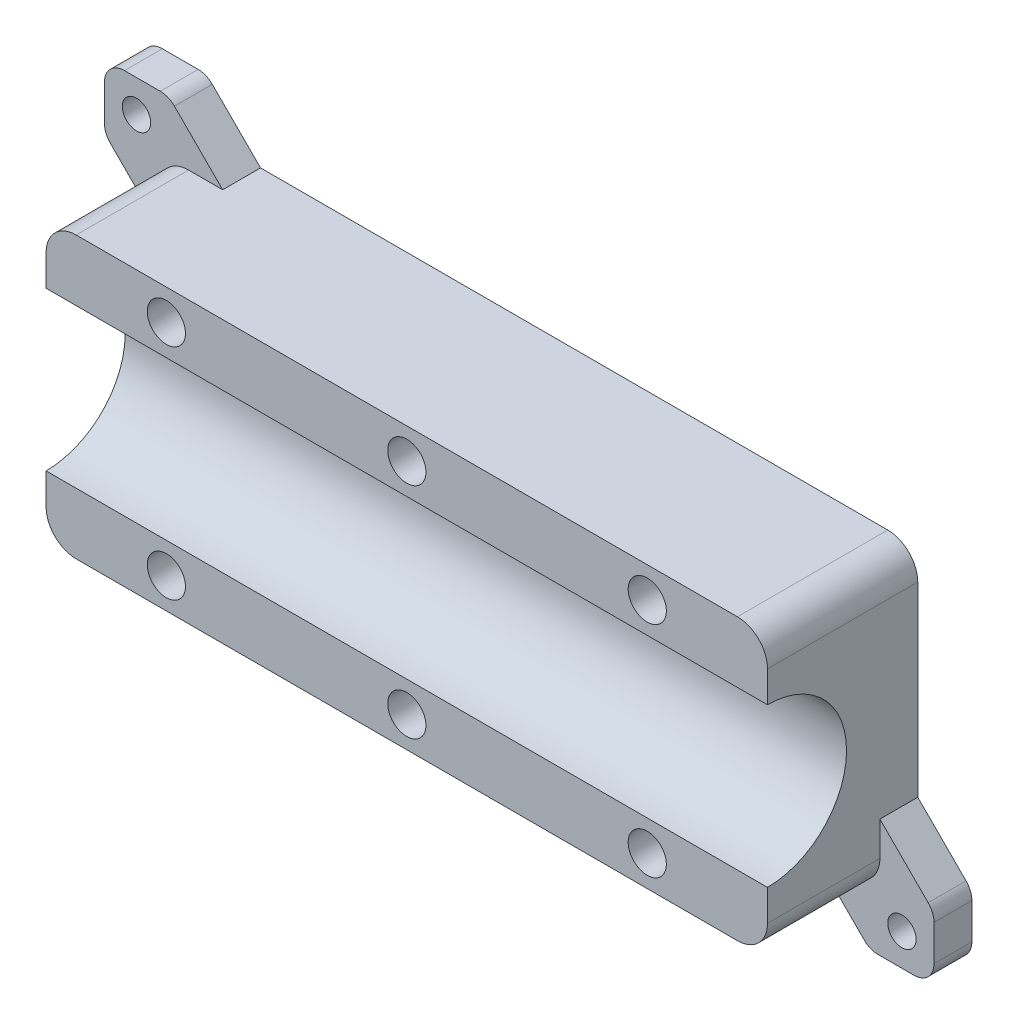
from build123d import *

# Parameters (mm, degrees)
SKETCH1_W               = 114.3
SKETCH1_H               = 44.45
BOSS_EXTRUDE1_DEPTH     = 5
BOSS_EXTRUDE2_DEPTH     = 114.3
SKETCH3_R               = 3.025
CUT_EXTRUDE1_DEPTH      = 5.5
LPATTERN1_COUNT         = 2
LPATTERN1_PITCH         = 38.1
LPATTERN1_COL_COUNT     = 2
LPATTERN1_COL_PITCH     = 38.1
MIRROR1_COPY_1_SKETCH_R = 3.025
MIRROR1_COPY_1_DEPTH    = 5.5
MIRROR1_COPY_2_SKETCH_R = 3.025
MIRROR1_COPY_2_DEPTH    = 5.5
SKETCH4_W               = 10.16
SKETCH4_H               = 10.16
BOSS_EXTRUDE3_DEPTH     = 6
M4_CLEARANCE_HOLE1_D    = 4.5
FILLET3_R               = 3.175
FILLET4_R               = 4.7625


with BuildPart() as part:
    # Sketch1 → Boss-Extrude1 (new body)
    with BuildSketch(Plane.XY):
        Rectangle(SKETCH1_W, SKETCH1_H)
    extrude(amount=BOSS_EXTRUDE1_DEPTH)

    # Sketch2 → Boss-Extrude2 (add)
    with BuildSketch(Plane.ZY.offset(57.15)):
        with BuildLine():
            Line((23.8125, 22.225), (5, 22.225))
            Line((5, 22.225), (5, -22.225))
            Line((5, -22.225), (23.8125, -22.225))
            Line((23.8125, -22.225), (23.8125, -12.5269))
            ThreePointArc((23.8125, -12.5269), (11.2856, 0), (23.8125, 12.5269))
            Line((23.8125, 12.5269), (23.8125, 22.225))
        make_face()
    extrude(amount=-BOSS_EXTRUDE2_DEPTH)

    # Sketch3 → Cut-Extrude1 (cut)
    with BuildSketch(Plane.XY.offset(23.8125)):
        with Locations((0, 17.37595)):
            Circle(SKETCH3_R)
    cut_extrude1 = extrude(amount=-CUT_EXTRUDE1_DEPTH, mode=Mode.SUBTRACT)

    # LPattern1: Cut-Extrude1 ×2
    with Locations(*[(i * LPATTERN1_PITCH, 0, 0) for i in range(1, LPATTERN1_COUNT)]):
        add(cut_extrude1, mode=Mode.SUBTRACT)

    # LPattern1 col: Cut-Extrude1 ×2
    with Locations(*[(-i * LPATTERN1_COL_PITCH, 0, 0) for i in range(1, LPATTERN1_COL_COUNT)]):
        add(cut_extrude1, mode=Mode.SUBTRACT)

    # Mirror1: Cut-Extrude1 across plane
    add(cut_extrude1.mirror(Plane.ZX), mode=Mode.SUBTRACT)

    # Mirror1 copy 1 sketch → Mirror1 copy 1 (cut)
    with BuildSketch(Plane(origin=(38.1, 0, 23.8125), x_dir=(1, 0, 0), z_dir=(0, 0, 1))):
        with Locations((0, -17.37595)):
            Circle(MIRROR1_COPY_1_SKETCH_R)
    extrude(amount=-MIRROR1_COPY_1_DEPTH, mode=Mode.SUBTRACT)

    # Mirror1 copy 2 sketch → Mirror1 copy 2 (cut)
    with BuildSketch(Plane(origin=(-38.1, 0, 23.8125), x_dir=(1, 0, 0), z_dir=(0, 0, 1))):
        with Locations((0, -17.37595)):
            Circle(MIRROR1_COPY_2_SKETCH_R)
    extrude(amount=-MIRROR1_COPY_2_DEPTH, mode=Mode.SUBTRACT)

    # Sketch4 → Boss-Extrude3 (add)
    with BuildSketch(Plane.XY):
        Polygon((-65.7225, 30.7975), (-55.5625, 20.6375), (-65.7225, 20.6375), align=None)
        Polygon((-65.7225, 30.7975), (-55.5625, 30.7975), (-55.5625, 20.6375), align=None)
        with Locations((60.6425, -25.7175)):
            Rectangle(SKETCH4_W, SKETCH4_H)
        Polygon((-55.5625, 30.7975), (-60.6425, 25.7175), (-57.15, 22.225), (-55.5625, 22.225), align=None)
        Polygon((-46.99, 22.225), (-55.5625, 30.7975), (-55.5625, 22.225), align=None)
        Polygon((-60.6425, 25.7175), (-65.7225, 20.6375), (-57.15, 20.6375), (-57.15, 22.225), align=None)
        Polygon((-57.15, 20.6375), (-65.7225, 20.6375), (-57.15, 12.065), align=None)
        Polygon((57.15, -20.6375), (65.7225, -20.6375), (57.15, -12.065), align=None)
        Polygon((46.99, -22.225), (55.5625, -30.7975), (55.5625, -22.225), align=None)
    extrude(amount=BOSS_EXTRUDE3_DEPTH)

    # M4 Clearance Hole1 (through all)
    with Locations(Plane.XY.offset(6)):
        with Locations((-60.6425, 25.7175), (60.6425, -25.7175)):
            Hole(M4_CLEARANCE_HOLE1_D / 2)

    # Fillet3
    fillet3_edges = [part.edges().sort_by_distance(p)[0] for p in [
        (-55.5625, 30.7975, 3),
        (-65.7225, 30.7975, 3),
        (-65.7225, 20.6375, 3),
        (55.5625, -30.7975, 3),
        (65.7225, -30.7975, 3),
        (65.7225, -20.6375, 3),
    ]]
    fillet(fillet3_edges, radius=FILLET3_R)

    # Fillet4
    fillet4_edges = [part.edges().sort_by_distance(p)[0] for p in [
        (57.15, -22.225, 14.90625),
        (-57.15, -22.225, 11.90625),
        (-57.15, 22.225, 14.90625),
        (57.15, 22.225, 11.90625),
    ]]
    fillet(fillet4_edges, radius=FILLET4_R)


solid = part.part
